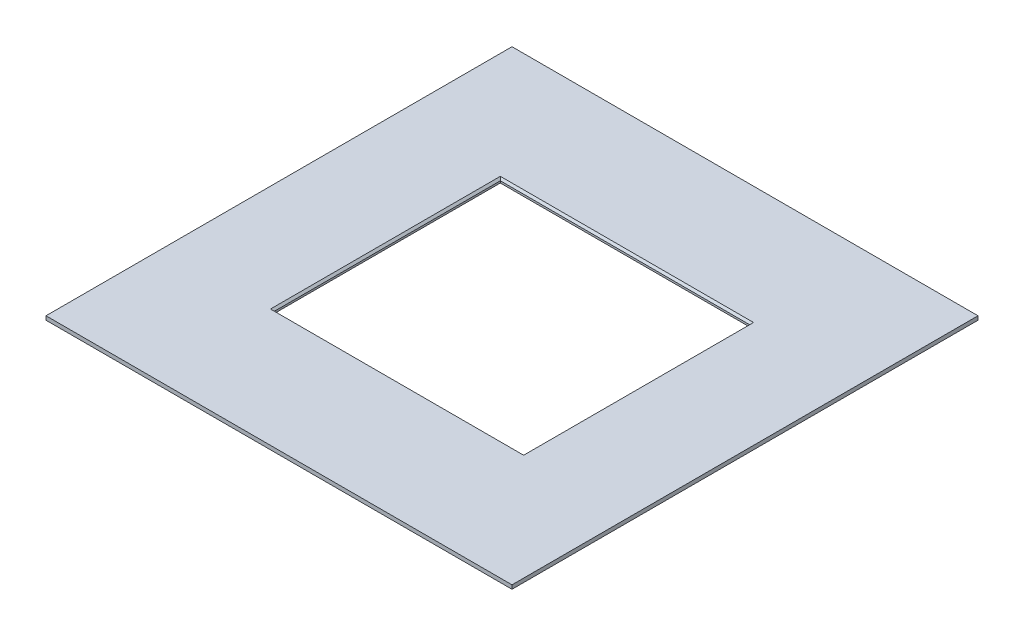
from build123d import *

# Parameters (mm, degrees)
SKETCH1_W           = 120
SKETCH1_H           = 120
SKETCH1_W_2         = 64.2
SKETCH1_H_2         = 58.2
BOSS_EXTRUDE1_DEPTH = 1
CHAMFER1_SIZE       = 0.5


with BuildPart() as part:
    # Sketch1 → Boss-Extrude1 (new body)
    with BuildSketch(Plane(origin=(0, 0, 0), x_dir=(1, 0, 0), z_dir=(0, 1, 0))):
        Rectangle(SKETCH1_W, SKETCH1_H)
        Rectangle(SKETCH1_W_2, SKETCH1_H_2, mode=Mode.SUBTRACT)
    extrude(amount=BOSS_EXTRUDE1_DEPTH)

    # Chamfer1
    chamfer1_edges = [part.edges().sort_by_distance(p)[0] for p in [
        (32.1, 1, 0),
        (0, 1, -29.1),
        (-32.1, 1, 0),
        (0, 1, 29.1),
    ]]
    chamfer(chamfer1_edges, length=CHAMFER1_SIZE)


solid = part.part
